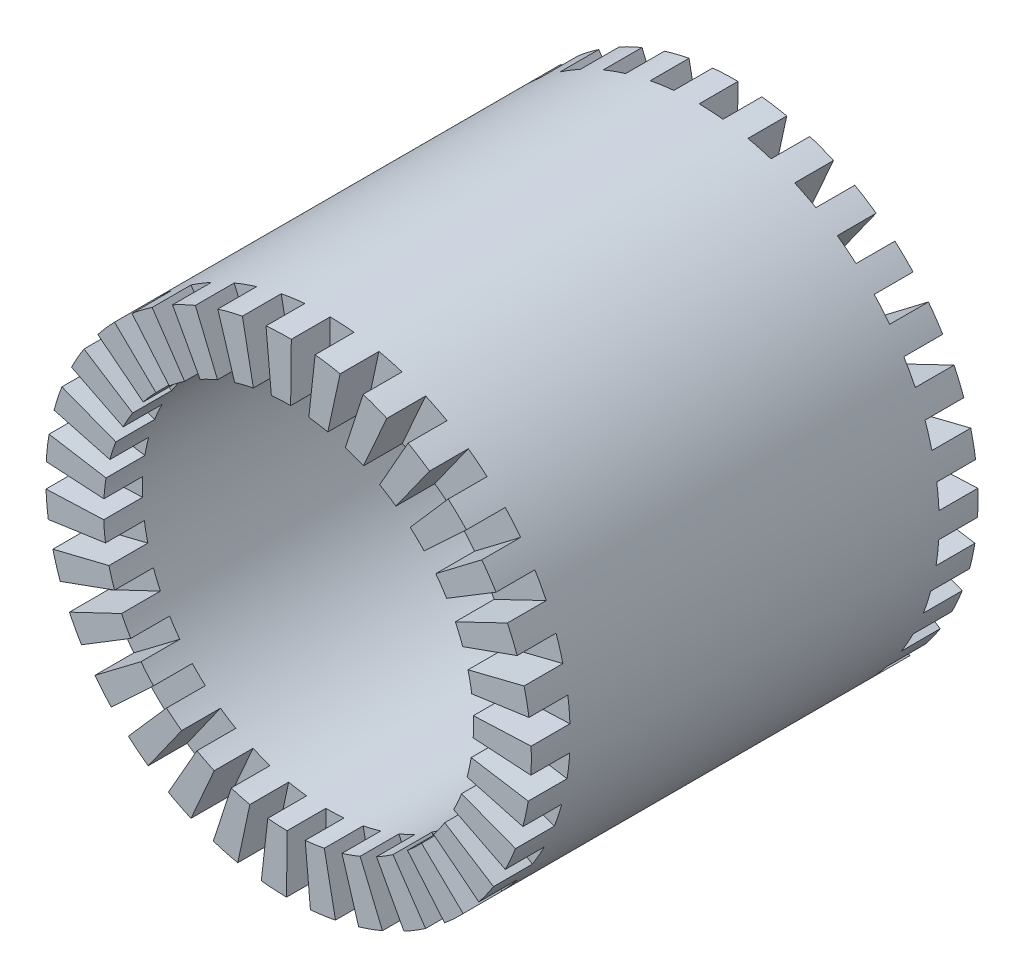
from build123d import *
from build123d.topology import SkipClean

# Parameters (mm, degrees)
SKETCH1_R             = 12.5
SKETCH1_R_2           = 9.525
BOSS_EXTRUDE1_DEPTH   = 19
BOSS_EXTRUDE2_DEPTH   = 2
CIRPATTERN1_COUNT     = 31
MIRROR1_COPY_1_DEPTH  = 2
MIRROR1_COPY_2_DEPTH  = 2
MIRROR1_COPY_3_DEPTH  = 2
MIRROR1_COPY_4_DEPTH  = 2
MIRROR1_COPY_5_DEPTH  = 2
MIRROR1_COPY_6_DEPTH  = 2
MIRROR1_COPY_7_DEPTH  = 2
MIRROR1_COPY_8_DEPTH  = 2
MIRROR1_COPY_9_DEPTH  = 2
MIRROR1_COPY_10_DEPTH = 2
MIRROR1_COPY_11_DEPTH = 2
MIRROR1_COPY_12_DEPTH = 2
MIRROR1_COPY_13_DEPTH = 2
MIRROR1_COPY_14_DEPTH = 2
MIRROR1_COPY_15_DEPTH = 2
MIRROR1_COPY_16_DEPTH = 2
MIRROR1_COPY_17_DEPTH = 2
MIRROR1_COPY_18_DEPTH = 2
MIRROR1_COPY_19_DEPTH = 2
MIRROR1_COPY_20_DEPTH = 2
MIRROR1_COPY_21_DEPTH = 2
MIRROR1_COPY_22_DEPTH = 2
MIRROR1_COPY_23_DEPTH = 2
MIRROR1_COPY_24_DEPTH = 2
MIRROR1_COPY_25_DEPTH = 2
MIRROR1_COPY_26_DEPTH = 2
MIRROR1_COPY_27_DEPTH = 2
MIRROR1_COPY_28_DEPTH = 2
MIRROR1_COPY_29_DEPTH = 2
MIRROR1_COPY_30_DEPTH = 2


with BuildPart() as part:
    # Sketch1 → Boss-Extrude1 (new body)
    with BuildSketch(Plane(origin=(0, 0, 0), x_dir=(0, 1, 0), z_dir=(0, 0, 1))):
        with Locations(Location((0, 0, 0), (0, 0, 270))):
            Circle(SKETCH1_R)
        with Locations(Location((0, 0, 0), (0, 0, 270))):
            Circle(SKETCH1_R_2, mode=Mode.SUBTRACT)
    extrude(amount=BOSS_EXTRUDE1_DEPTH)

    # Sketch2 → Boss-Extrude2 (add)
    with SkipClean():  # the faces are left unmerged after this step: merging them gives an invalid solid
        with BuildSketch(Plane.XY.offset(19)):
            with BuildLine():
                Line((-7.483826279, 5.89219562), (-9.82129433, 7.732540184))
                ThreePointArc((-9.82129433, 7.732540184), (-9.404687246, 8.234188351), (-8.962486633, 8.713428335))
                Line((-8.962486633, 8.713428335), (-6.829414814, 6.639632392))
                ThreePointArc((-6.829414814, 6.639632392), (-7.166371682, 6.274451523), (-7.483826279, 5.89219562))
            make_face()
        boss_extrude2 = extrude(amount=BOSS_EXTRUDE2_DEPTH)

    # CirPattern1: Boss-Extrude2 ×31 about axis
    with SkipClean():  # the faces are left unmerged after this step: merging them gives an invalid solid
        cirpattern1_axis = Axis((0, 0, 0), (0, 0, 1))
        for i in range(1, CIRPATTERN1_COUNT):
            add(boss_extrude2.rotate(cirpattern1_axis, i * 360 / CIRPATTERN1_COUNT))

    # Mirror1: Boss-Extrude2 across plane
    with SkipClean():  # the faces are left unmerged after this step: merging them gives an invalid solid
        add(boss_extrude2.mirror(Plane.XY.offset(9.5)))

    # Mirror1 copy 1 sketch → Mirror1 copy 1 (add)
    with SkipClean():  # the faces are left unmerged after this step: merging them gives an invalid solid
        with BuildSketch(Plane(origin=(0, 0, 0), x_dir=(0.9795299412524945, 0.20129852008866006, 0), z_dir=(0, 0, -1))):
            with BuildLine():
                Line((-7.483826279, -5.89219562), (-9.82129433, -7.732540184))
                ThreePointArc((-9.82129433, -7.732540184), (-9.404687246, -8.234188351), (-8.962486633, -8.713428335))
                Line((-8.962486633, -8.713428335), (-6.829414814, -6.639632392))
                ThreePointArc((-6.829414814, -6.639632392), (-7.166371682, -6.274451523), (-7.483826279, -5.89219562))
            make_face()
        extrude(amount=MIRROR1_COPY_1_DEPTH)

    # Mirror1 copy 2 sketch → Mirror1 copy 2 (add)
    with SkipClean():  # the faces are left unmerged after this step: merging them gives an invalid solid
        with BuildSketch(Plane(origin=(0, 0, 0), x_dir=(0.9189578116202306, 0.39435585511331855, 0), z_dir=(0, 0, -1))):
            with BuildLine():
                Line((-7.483826279, -5.89219562), (-9.82129433, -7.732540184))
                ThreePointArc((-9.82129433, -7.732540184), (-9.404687246, -8.234188351), (-8.962486633, -8.713428335))
                Line((-8.962486633, -8.713428335), (-6.829414814, -6.639632392))
                ThreePointArc((-6.829414814, -6.639632392), (-7.166371682, -6.274451523), (-7.483826279, -5.89219562))
            make_face()
        extrude(amount=MIRROR1_COPY_2_DEPTH)

    # Mirror1 copy 3 sketch → Mirror1 copy 3 (add)
    with SkipClean():  # the faces are left unmerged after this step: merging them gives an invalid solid
        with BuildSketch(Plane(origin=(0, 0, 0), x_dir=(0.8207634412072763, 0.5712682150947924, 0), z_dir=(0, 0, -1))):
            with BuildLine():
                Line((-7.483826279, -5.89219562), (-9.82129433, -7.732540184))
                ThreePointArc((-9.82129433, -7.732540184), (-9.404687246, -8.234188351), (-8.962486633, -8.713428335))
                Line((-8.962486633, -8.713428335), (-6.829414814, -6.639632392))
                ThreePointArc((-6.829414814, -6.639632392), (-7.166371682, -6.274451523), (-7.483826279, -5.89219562))
            make_face()
        extrude(amount=MIRROR1_COPY_3_DEPTH)

    # Mirror1 copy 4 sketch → Mirror1 copy 4 (add)
    with SkipClean():  # the faces are left unmerged after this step: merging them gives an invalid solid
        with BuildSketch(Plane(origin=(0, 0, 0), x_dir=(0.6889669190756866, 0.7247927872291199, 0), z_dir=(0, 0, -1))):
            with BuildLine():
                Line((-7.483826279, -5.89219562), (-9.82129433, -7.732540184))
                ThreePointArc((-9.82129433, -7.732540184), (-9.404687246, -8.234188351), (-8.962486633, -8.713428335))
                Line((-8.962486633, -8.713428335), (-6.829414814, -6.639632392))
                ThreePointArc((-6.829414814, -6.639632392), (-7.166371682, -6.274451523), (-7.483826279, -5.89219562))
            make_face()
        extrude(amount=MIRROR1_COPY_4_DEPTH)

    # Mirror1 copy 5 sketch → Mirror1 copy 5 (add)
    with SkipClean():  # the faces are left unmerged after this step: merging them gives an invalid solid
        with BuildSketch(Plane(origin=(0, 0, 0), x_dir=(0.5289640103269624, 0.8486442574947509, 0), z_dir=(0, 0, -1))):
            with BuildLine():
                Line((-7.483826279, -5.89219562), (-9.82129433, -7.732540184))
                ThreePointArc((-9.82129433, -7.732540184), (-9.404687246, -8.234188351), (-8.962486633, -8.713428335))
                Line((-8.962486633, -8.713428335), (-6.829414814, -6.639632392))
                ThreePointArc((-6.829414814, -6.639632392), (-7.166371682, -6.274451523), (-7.483826279, -5.89219562))
            make_face()
        extrude(amount=MIRROR1_COPY_5_DEPTH)

    # Mirror1 copy 6 sketch → Mirror1 copy 6 (add)
    with SkipClean():  # the faces are left unmerged after this step: merging them gives an invalid solid
        with BuildSketch(Plane(origin=(0, 0, 0), x_dir=(0.34730525284482006, 0.9377521321470805, 0), z_dir=(0, 0, -1))):
            with BuildLine():
                Line((-7.483826279, -5.89219562), (-9.82129433, -7.732540184))
                ThreePointArc((-9.82129433, -7.732540184), (-9.404687246, -8.234188351), (-8.962486633, -8.713428335))
                Line((-8.962486633, -8.713428335), (-6.829414814, -6.639632392))
                ThreePointArc((-6.829414814, -6.639632392), (-7.166371682, -6.274451523), (-7.483826279, -5.89219562))
            make_face()
        extrude(amount=MIRROR1_COPY_6_DEPTH)

    # Mirror1 copy 7 sketch → Mirror1 copy 7 (add)
    with SkipClean():  # the faces are left unmerged after this step: merging them gives an invalid solid
        with BuildSketch(Plane(origin=(0, 0, 0), x_dir=(0.15142777750457648, 0.9884683243281114, 0), z_dir=(0, 0, -1))):
            with BuildLine():
                Line((-7.483826279, -5.89219562), (-9.82129433, -7.732540184))
                ThreePointArc((-9.82129433, -7.732540184), (-9.404687246, -8.234188351), (-8.962486633, -8.713428335))
                Line((-8.962486633, -8.713428335), (-6.829414814, -6.639632392))
                ThreePointArc((-6.829414814, -6.639632392), (-7.166371682, -6.274451523), (-7.483826279, -5.89219562))
            make_face()
        extrude(amount=MIRROR1_COPY_7_DEPTH)

    # Mirror1 copy 8 sketch → Mirror1 copy 8 (add)
    with SkipClean():  # the faces are left unmerged after this step: merging them gives an invalid solid
        with BuildSketch(Plane(origin=(0, 0, 0), x_dir=(-0.05064916883871264, 0.9987165071710528, 0), z_dir=(0, 0, -1))):
            with BuildLine():
                Line((-7.483826279, -5.89219562), (-9.82129433, -7.732540184))
                ThreePointArc((-9.82129433, -7.732540184), (-9.404687246, -8.234188351), (-8.962486633, -8.713428335))
                Line((-8.962486633, -8.713428335), (-6.829414814, -6.639632392))
                ThreePointArc((-6.829414814, -6.639632392), (-7.166371682, -6.274451523), (-7.483826279, -5.89219562))
            make_face()
        extrude(amount=MIRROR1_COPY_8_DEPTH)

    # Mirror1 copy 9 sketch → Mirror1 copy 9 (add)
    with SkipClean():  # the faces are left unmerged after this step: merging them gives an invalid solid
        with BuildSketch(Plane(origin=(0, 0, 0), x_dir=(-0.2506525322587204, 0.9680771188662043, 0), z_dir=(0, 0, -1))):
            with BuildLine():
                Line((-7.483826279, -5.89219562), (-9.82129433, -7.732540184))
                ThreePointArc((-9.82129433, -7.732540184), (-9.404687246, -8.234188351), (-8.962486633, -8.713428335))
                Line((-8.962486633, -8.713428335), (-6.829414814, -6.639632392))
                ThreePointArc((-6.829414814, -6.639632392), (-7.166371682, -6.274451523), (-7.483826279, -5.89219562))
            make_face()
        extrude(amount=MIRROR1_COPY_9_DEPTH)

    # Mirror1 copy 10 sketch → Mirror1 copy 10 (add)
    with SkipClean():  # the faces are left unmerged after this step: merging them gives an invalid solid
        with BuildSketch(Plane(origin=(0, 0, 0), x_dir=(-0.4403941515576344, 0.8978045395707416, 0), z_dir=(0, 0, -1))):
            with BuildLine():
                Line((-7.483826279, -5.89219562), (-9.82129433, -7.732540184))
                ThreePointArc((-9.82129433, -7.732540184), (-9.404687246, -8.234188351), (-8.962486633, -8.713428335))
                Line((-8.962486633, -8.713428335), (-6.829414814, -6.639632392))
                ThreePointArc((-6.829414814, -6.639632392), (-7.166371682, -6.274451523), (-7.483826279, -5.89219562))
            make_face()
        extrude(amount=MIRROR1_COPY_10_DEPTH)

    # Mirror1 copy 11 sketch → Mirror1 copy 11 (add)
    with SkipClean():  # the faces are left unmerged after this step: merging them gives an invalid solid
        with BuildSketch(Plane(origin=(0, 0, 0), x_dir=(-0.6121059825476629, 0.7907757369376985, 0), z_dir=(0, 0, -1))):
            with BuildLine():
                Line((-7.483826279, -5.89219562), (-9.82129433, -7.732540184))
                ThreePointArc((-9.82129433, -7.732540184), (-9.404687246, -8.234188351), (-8.962486633, -8.713428335))
                Line((-8.962486633, -8.713428335), (-6.829414814, -6.639632392))
                ThreePointArc((-6.829414814, -6.639632392), (-7.166371682, -6.274451523), (-7.483826279, -5.89219562))
            make_face()
        extrude(amount=MIRROR1_COPY_11_DEPTH)

    # Mirror1 copy 12 sketch → Mirror1 copy 12 (add)
    with SkipClean():  # the faces are left unmerged after this step: merging them gives an invalid solid
        with BuildSketch(Plane(origin=(0, 0, 0), x_dir=(-0.7587581226927912, 0.6513724827222218, 0), z_dir=(0, 0, -1))):
            with BuildLine():
                Line((-7.483826279, -5.89219562), (-9.82129433, -7.732540184))
                ThreePointArc((-9.82129433, -7.732540184), (-9.404687246, -8.234188351), (-8.962486633, -8.713428335))
                Line((-8.962486633, -8.713428335), (-6.829414814, -6.639632392))
                ThreePointArc((-6.829414814, -6.639632392), (-7.166371682, -6.274451523), (-7.483826279, -5.89219562))
            make_face()
        extrude(amount=MIRROR1_COPY_12_DEPTH)

    # Mirror1 copy 13 sketch → Mirror1 copy 13 (add)
    with SkipClean():  # the faces are left unmerged after this step: merging them gives an invalid solid
        with BuildSketch(Plane(origin=(0, 0, 0), x_dir=(-0.8743466161445821, 0.48530196253108104, 0), z_dir=(0, 0, -1))):
            with BuildLine():
                Line((-7.483826279, -5.89219562), (-9.82129433, -7.732540184))
                ThreePointArc((-9.82129433, -7.732540184), (-9.404687246, -8.234188351), (-8.962486633, -8.713428335))
                Line((-8.962486633, -8.713428335), (-6.829414814, -6.639632392))
                ThreePointArc((-6.829414814, -6.639632392), (-7.166371682, -6.274451523), (-7.483826279, -5.89219562))
            make_face()
        extrude(amount=MIRROR1_COPY_13_DEPTH)

    # Mirror1 copy 14 sketch → Mirror1 copy 14 (add)
    with SkipClean():  # the faces are left unmerged after this step: merging them gives an invalid solid
        with BuildSketch(Plane(origin=(0, 0, 0), x_dir=(-0.9541392564000489, 0.2993631229733576, 0), z_dir=(0, 0, -1))):
            with BuildLine():
                Line((-7.483826279, -5.89219562), (-9.82129433, -7.732540184))
                ThreePointArc((-9.82129433, -7.732540184), (-9.404687246, -8.234188351), (-8.962486633, -8.713428335))
                Line((-8.962486633, -8.713428335), (-6.829414814, -6.639632392))
                ThreePointArc((-6.829414814, -6.639632392), (-7.166371682, -6.274451523), (-7.483826279, -5.89219562))
            make_face()
        extrude(amount=MIRROR1_COPY_14_DEPTH)

    # Mirror1 copy 15 sketch → Mirror1 copy 15 (add)
    with SkipClean():  # the faces are left unmerged after this step: merging them gives an invalid solid
        with BuildSketch(Plane(origin=(0, 0, 0), x_dir=(-0.9948693233918952, 0.10116832198743228, 0), z_dir=(0, 0, -1))):
            with BuildLine():
                Line((-7.483826279, -5.89219562), (-9.82129433, -7.732540184))
                ThreePointArc((-9.82129433, -7.732540184), (-9.404687246, -8.234188351), (-8.962486633, -8.713428335))
                Line((-8.962486633, -8.713428335), (-6.829414814, -6.639632392))
                ThreePointArc((-6.829414814, -6.639632392), (-7.166371682, -6.274451523), (-7.483826279, -5.89219562))
            make_face()
        extrude(amount=MIRROR1_COPY_15_DEPTH)

    # Mirror1 copy 16 sketch → Mirror1 copy 16 (add)
    with SkipClean():  # the faces are left unmerged after this step: merging them gives an invalid solid
        with BuildSketch(Plane(origin=(0, 0, 0), x_dir=(-0.9948693233918952, -0.10116832198743204, 0), z_dir=(0, 0, -1))):
            with BuildLine():
                Line((-7.483826279, -5.89219562), (-9.82129433, -7.732540184))
                ThreePointArc((-9.82129433, -7.732540184), (-9.404687246, -8.234188351), (-8.962486633, -8.713428335))
                Line((-8.962486633, -8.713428335), (-6.829414814, -6.639632392))
                ThreePointArc((-6.829414814, -6.639632392), (-7.166371682, -6.274451523), (-7.483826279, -5.89219562))
            make_face()
        extrude(amount=MIRROR1_COPY_16_DEPTH)

    # Mirror1 copy 17 sketch → Mirror1 copy 17 (add)
    with SkipClean():  # the faces are left unmerged after this step: merging them gives an invalid solid
        with BuildSketch(Plane(origin=(0, 0, 0), x_dir=(-0.9541392564000488, -0.2993631229733582, 0), z_dir=(0, 0, -1))):
            with BuildLine():
                Line((-7.483826279, -5.89219562), (-9.82129433, -7.732540184))
                ThreePointArc((-9.82129433, -7.732540184), (-9.404687246, -8.234188351), (-8.962486633, -8.713428335))
                Line((-8.962486633, -8.713428335), (-6.829414814, -6.639632392))
                ThreePointArc((-6.829414814, -6.639632392), (-7.166371682, -6.274451523), (-7.483826279, -5.89219562))
            make_face()
        extrude(amount=MIRROR1_COPY_17_DEPTH)

    # Mirror1 copy 18 sketch → Mirror1 copy 18 (add)
    with SkipClean():  # the faces are left unmerged after this step: merging them gives an invalid solid
        with BuildSketch(Plane(origin=(0, 0, 0), x_dir=(-0.8743466161445822, -0.4853019625310808, 0), z_dir=(0, 0, -1))):
            with BuildLine():
                Line((-7.483826279, -5.89219562), (-9.82129433, -7.732540184))
                ThreePointArc((-9.82129433, -7.732540184), (-9.404687246, -8.234188351), (-8.962486633, -8.713428335))
                Line((-8.962486633, -8.713428335), (-6.829414814, -6.639632392))
                ThreePointArc((-6.829414814, -6.639632392), (-7.166371682, -6.274451523), (-7.483826279, -5.89219562))
            make_face()
        extrude(amount=MIRROR1_COPY_18_DEPTH)

    # Mirror1 copy 19 sketch → Mirror1 copy 19 (add)
    with SkipClean():  # the faces are left unmerged after this step: merging them gives an invalid solid
        with BuildSketch(Plane(origin=(0, 0, 0), x_dir=(-0.7587581226927907, -0.6513724827222224, 0), z_dir=(0, 0, -1))):
            with BuildLine():
                Line((-7.483826279, -5.89219562), (-9.82129433, -7.732540184))
                ThreePointArc((-9.82129433, -7.732540184), (-9.404687246, -8.234188351), (-8.962486633, -8.713428335))
                Line((-8.962486633, -8.713428335), (-6.829414814, -6.639632392))
                ThreePointArc((-6.829414814, -6.639632392), (-7.166371682, -6.274451523), (-7.483826279, -5.89219562))
            make_face()
        extrude(amount=MIRROR1_COPY_19_DEPTH)

    # Mirror1 copy 20 sketch → Mirror1 copy 20 (add)
    with SkipClean():  # the faces are left unmerged after this step: merging them gives an invalid solid
        with BuildSketch(Plane(origin=(0, 0, 0), x_dir=(-0.6121059825476627, -0.7907757369376986, 0), z_dir=(0, 0, -1))):
            with BuildLine():
                Line((-7.483826279, -5.89219562), (-9.82129433, -7.732540184))
                ThreePointArc((-9.82129433, -7.732540184), (-9.404687246, -8.234188351), (-8.962486633, -8.713428335))
                Line((-8.962486633, -8.713428335), (-6.829414814, -6.639632392))
                ThreePointArc((-6.829414814, -6.639632392), (-7.166371682, -6.274451523), (-7.483826279, -5.89219562))
            make_face()
        extrude(amount=MIRROR1_COPY_20_DEPTH)

    # Mirror1 copy 21 sketch → Mirror1 copy 21 (add)
    with SkipClean():  # the faces are left unmerged after this step: merging them gives an invalid solid
        with BuildSketch(Plane(origin=(0, 0, 0), x_dir=(-0.44039415155763423, -0.8978045395707417, 0), z_dir=(0, 0, -1))):
            with BuildLine():
                Line((-7.483826279, -5.89219562), (-9.82129433, -7.732540184))
                ThreePointArc((-9.82129433, -7.732540184), (-9.404687246, -8.234188351), (-8.962486633, -8.713428335))
                Line((-8.962486633, -8.713428335), (-6.829414814, -6.639632392))
                ThreePointArc((-6.829414814, -6.639632392), (-7.166371682, -6.274451523), (-7.483826279, -5.89219562))
            make_face()
        extrude(amount=MIRROR1_COPY_21_DEPTH)

    # Mirror1 copy 22 sketch → Mirror1 copy 22 (add)
    with SkipClean():  # the faces are left unmerged after this step: merging them gives an invalid solid
        with BuildSketch(Plane(origin=(0, 0, 0), x_dir=(-0.2506525322587205, -0.9680771188662043, 0), z_dir=(0, 0, -1))):
            with BuildLine():
                Line((-7.483826279, -5.89219562), (-9.82129433, -7.732540184))
                ThreePointArc((-9.82129433, -7.732540184), (-9.404687246, -8.234188351), (-8.962486633, -8.713428335))
                Line((-8.962486633, -8.713428335), (-6.829414814, -6.639632392))
                ThreePointArc((-6.829414814, -6.639632392), (-7.166371682, -6.274451523), (-7.483826279, -5.89219562))
            make_face()
        extrude(amount=MIRROR1_COPY_22_DEPTH)

    # Mirror1 copy 23 sketch → Mirror1 copy 23 (add)
    with SkipClean():  # the faces are left unmerged after this step: merging them gives an invalid solid
        with BuildSketch(Plane(origin=(0, 0, 0), x_dir=(-0.05064916883871266, -0.9987165071710528, 0), z_dir=(0, 0, -1))):
            with BuildLine():
                Line((-7.483826279, -5.89219562), (-9.82129433, -7.732540184))
                ThreePointArc((-9.82129433, -7.732540184), (-9.404687246, -8.234188351), (-8.962486633, -8.713428335))
                Line((-8.962486633, -8.713428335), (-6.829414814, -6.639632392))
                ThreePointArc((-6.829414814, -6.639632392), (-7.166371682, -6.274451523), (-7.483826279, -5.89219562))
            make_face()
        extrude(amount=MIRROR1_COPY_23_DEPTH)

    # Mirror1 copy 24 sketch → Mirror1 copy 24 (add)
    with SkipClean():  # the faces are left unmerged after this step: merging them gives an invalid solid
        with BuildSketch(Plane(origin=(0, 0, 0), x_dir=(0.15142777750457756, -0.9884683243281113, 0), z_dir=(0, 0, -1))):
            with BuildLine():
                Line((-7.483826279, -5.89219562), (-9.82129433, -7.732540184))
                ThreePointArc((-9.82129433, -7.732540184), (-9.404687246, -8.234188351), (-8.962486633, -8.713428335))
                Line((-8.962486633, -8.713428335), (-6.829414814, -6.639632392))
                ThreePointArc((-6.829414814, -6.639632392), (-7.166371682, -6.274451523), (-7.483826279, -5.89219562))
            make_face()
        extrude(amount=MIRROR1_COPY_24_DEPTH)

    # Mirror1 copy 25 sketch → Mirror1 copy 25 (add)
    with SkipClean():  # the faces are left unmerged after this step: merging them gives an invalid solid
        with BuildSketch(Plane(origin=(0, 0, 0), x_dir=(0.3473052528448203, -0.9377521321470804, 0), z_dir=(0, 0, -1))):
            with BuildLine():
                Line((-7.483826279, -5.89219562), (-9.82129433, -7.732540184))
                ThreePointArc((-9.82129433, -7.732540184), (-9.404687246, -8.234188351), (-8.962486633, -8.713428335))
                Line((-8.962486633, -8.713428335), (-6.829414814, -6.639632392))
                ThreePointArc((-6.829414814, -6.639632392), (-7.166371682, -6.274451523), (-7.483826279, -5.89219562))
            make_face()
        extrude(amount=MIRROR1_COPY_25_DEPTH)

    # Mirror1 copy 26 sketch → Mirror1 copy 26 (add)
    with SkipClean():  # the faces are left unmerged after this step: merging them gives an invalid solid
        with BuildSketch(Plane(origin=(0, 0, 0), x_dir=(0.5289640103269624, -0.848644257494751, 0), z_dir=(0, 0, -1))):
            with BuildLine():
                Line((-7.483826279, -5.89219562), (-9.82129433, -7.732540184))
                ThreePointArc((-9.82129433, -7.732540184), (-9.404687246, -8.234188351), (-8.962486633, -8.713428335))
                Line((-8.962486633, -8.713428335), (-6.829414814, -6.639632392))
                ThreePointArc((-6.829414814, -6.639632392), (-7.166371682, -6.274451523), (-7.483826279, -5.89219562))
            make_face()
        extrude(amount=MIRROR1_COPY_26_DEPTH)

    # Mirror1 copy 27 sketch → Mirror1 copy 27 (add)
    with SkipClean():  # the faces are left unmerged after this step: merging them gives an invalid solid
        with BuildSketch(Plane(origin=(0, 0, 0), x_dir=(0.6889669190756865, -0.72479278722912, 0), z_dir=(0, 0, -1))):
            with BuildLine():
                Line((-7.483826279, -5.89219562), (-9.82129433, -7.732540184))
                ThreePointArc((-9.82129433, -7.732540184), (-9.404687246, -8.234188351), (-8.962486633, -8.713428335))
                Line((-8.962486633, -8.713428335), (-6.829414814, -6.639632392))
                ThreePointArc((-6.829414814, -6.639632392), (-7.166371682, -6.274451523), (-7.483826279, -5.89219562))
            make_face()
        extrude(amount=MIRROR1_COPY_27_DEPTH)

    # Mirror1 copy 28 sketch → Mirror1 copy 28 (add)
    with SkipClean():  # the faces are left unmerged after this step: merging them gives an invalid solid
        with BuildSketch(Plane(origin=(0, 0, 0), x_dir=(0.8207634412072767, -0.5712682150947916, 0), z_dir=(0, 0, -1))):
            with BuildLine():
                Line((-7.483826279, -5.89219562), (-9.82129433, -7.732540184))
                ThreePointArc((-9.82129433, -7.732540184), (-9.404687246, -8.234188351), (-8.962486633, -8.713428335))
                Line((-8.962486633, -8.713428335), (-6.829414814, -6.639632392))
                ThreePointArc((-6.829414814, -6.639632392), (-7.166371682, -6.274451523), (-7.483826279, -5.89219562))
            make_face()
        extrude(amount=MIRROR1_COPY_28_DEPTH)

    # Mirror1 copy 29 sketch → Mirror1 copy 29 (add)
    with SkipClean():  # the faces are left unmerged after this step: merging them gives an invalid solid
        with BuildSketch(Plane(origin=(0, 0, 0), x_dir=(0.9189578116202309, -0.39435585511331794, 0), z_dir=(0, 0, -1))):
            with BuildLine():
                Line((-7.483826279, -5.89219562), (-9.82129433, -7.732540184))
                ThreePointArc((-9.82129433, -7.732540184), (-9.404687246, -8.234188351), (-8.962486633, -8.713428335))
                Line((-8.962486633, -8.713428335), (-6.829414814, -6.639632392))
                ThreePointArc((-6.829414814, -6.639632392), (-7.166371682, -6.274451523), (-7.483826279, -5.89219562))
            make_face()
        extrude(amount=MIRROR1_COPY_29_DEPTH)

    # Mirror1 copy 30 sketch → Mirror1 copy 30 (add)
    with SkipClean():  # the faces are left unmerged after this step: merging them gives an invalid solid
        with BuildSketch(Plane(origin=(0, 0, 0), x_dir=(0.9795299412524945, -0.20129852008866028, 0), z_dir=(0, 0, -1))):
            with BuildLine():
                Line((-7.483826279, -5.89219562), (-9.82129433, -7.732540184))
                ThreePointArc((-9.82129433, -7.732540184), (-9.404687246, -8.234188351), (-8.962486633, -8.713428335))
                Line((-8.962486633, -8.713428335), (-6.829414814, -6.639632392))
                ThreePointArc((-6.829414814, -6.639632392), (-7.166371682, -6.274451523), (-7.483826279, -5.89219562))
            make_face()
        extrude(amount=MIRROR1_COPY_30_DEPTH)


solid = part.part
